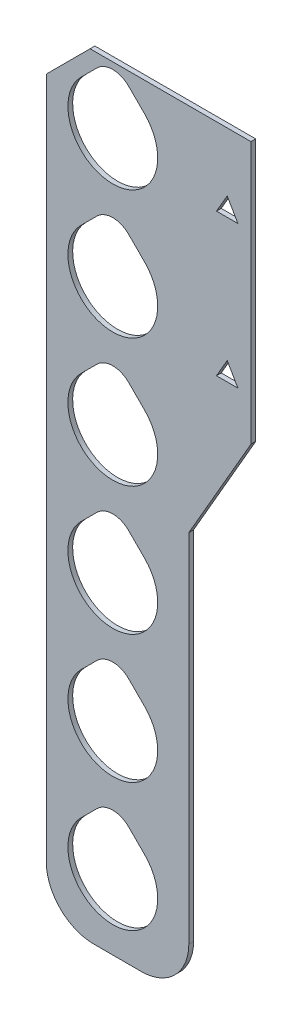
from build123d import *

# Parameters (mm, degrees)
EXTRUDE_1_DEPTH = 1


with BuildPart() as part:
    # 草图1 → 凸台-拉伸1 (new body)
    with BuildSketch(Plane.XY):
        with BuildLine():
            Line((-4, -15), (6, -15))
            ThreePointArc((6, -15), (13.071067812, -12.071067812), (16, -5))
            Line((16, -5), (16, 70))
            Line((16, 70), (29.076696831, 92.649503306))
            Line((29.076696831, 92.649503306), (29.076696831, 147.803847577))
            Line((29.076696831, 147.803847577), (-4.776615382, 147.803847577))
            Line((-4.776615382, 147.803847577), (-14, 138.58046296))
            Line((-14, 138.58046296), (-14, -5))
            ThreePointArc((-14, -5), (-11.071067812, -12.071067812), (-4, -15))
        make_face()
        with BuildLine():
            ThreePointArc((-6.682159082, 114.682159082), (0, 98.55), (6.682159082, 114.682159082))
            Line((6.682159082, 114.682159082), (3.341079541, 118.023238623))
            ThreePointArc((3.341079541, 118.023238623), (0, 119.407159082), (-3.341079541, 118.023238623))
            Line((-3.341079541, 118.023238623), (-6.682159082, 114.682159082))
        make_face(mode=Mode.SUBTRACT)
        with BuildLine():
            ThreePointArc((-6.682159082, 141.682159082), (0, 125.55), (6.682159082, 141.682159082))
            Line((6.682159082, 141.682159082), (3.341079541, 145.023238623))
            ThreePointArc((3.341079541, 145.023238623), (0, 146.407159082), (-3.341079541, 145.023238623))
            Line((-3.341079541, 145.023238623), (-6.682159082, 141.682159082))
        make_face(mode=Mode.SUBTRACT)
        with BuildLine():
            ThreePointArc((-6.682159082, 87.682159082), (0, 71.55), (6.682159082, 87.682159082))
            Line((6.682159082, 87.682159082), (3.341079541, 91.023238623))
            ThreePointArc((3.341079541, 91.023238623), (0, 92.407159082), (-3.341079541, 91.023238623))
            Line((-3.341079541, 91.023238623), (-6.682159082, 87.682159082))
        make_face(mode=Mode.SUBTRACT)
        with BuildLine():
            ThreePointArc((3.341079541, 64.023238623), (0, 65.407159082), (-3.341079541, 64.023238623))
            Line((-3.341079541, 64.023238623), (-6.682159082, 60.682159082))
            ThreePointArc((-6.682159082, 60.682159082), (0, 44.55), (6.682159082, 60.682159082))
            Line((6.682159082, 60.682159082), (3.341079541, 64.023238623))
        make_face(mode=Mode.SUBTRACT)
        with BuildLine():
            ThreePointArc((-6.682159082, 33.682159082), (0, 17.55), (6.682159082, 33.682159082))
            Line((6.682159082, 33.682159082), (3.341079541, 37.023238623))
            ThreePointArc((3.341079541, 37.023238623), (0, 38.407159082), (-3.341079541, 37.023238623))
            Line((-3.341079541, 37.023238623), (-6.682159082, 33.682159082))
        make_face(mode=Mode.SUBTRACT)
        with BuildLine():
            ThreePointArc((3.341079541, 10.023238623), (0, 11.407159082), (-3.341079541, 10.023238623))
            Line((-3.341079541, 10.023238623), (-6.682159082, 6.682159082))
            ThreePointArc((-6.682159082, 6.682159082), (0, -9.45), (6.682159082, 6.682159082))
            Line((6.682159082, 6.682159082), (3.341079541, 10.023238623))
        make_face(mode=Mode.SUBTRACT)
        Polygon((24.076696831, 105.403847577), (21.825030781, 101.503847577), (26.32836288, 101.503847577), align=None, mode=Mode.SUBTRACT)
        Polygon((26.32836288, 131.503847577), (24.076696831, 135.403847577), (21.825030781, 131.503847577), align=None, mode=Mode.SUBTRACT)
    extrude(amount=EXTRUDE_1_DEPTH)


solid = part.part
